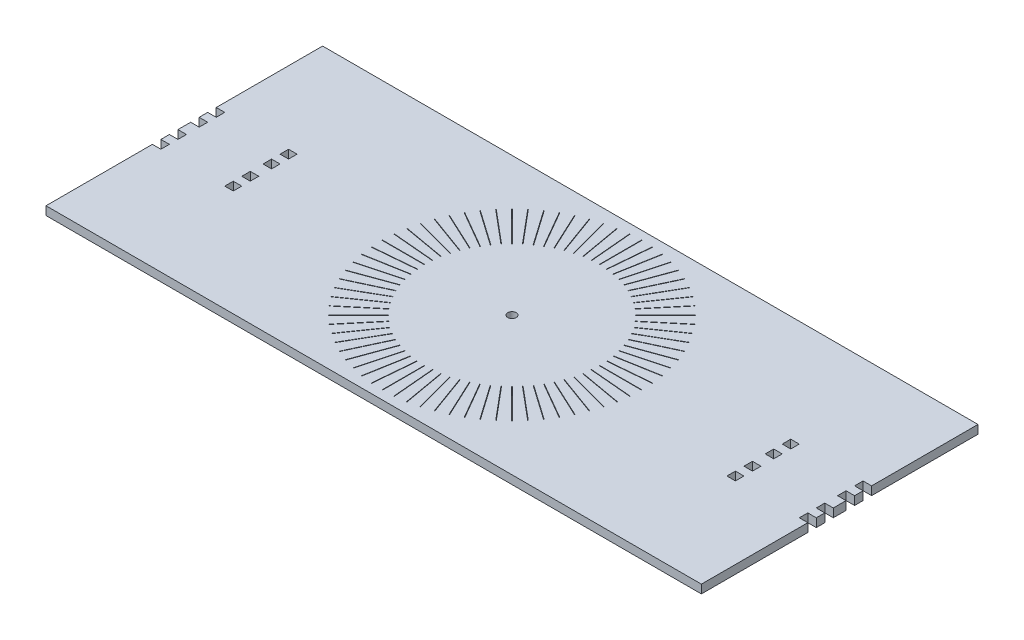
from build123d import *

# Parameters (mm, degrees)
SKETCH1_W           = 391.16
SKETCH1_H           = 165.1
SKETCH1_R           = 2.54
BOSS_EXTRUDE1_DEPTH = 5.08
SKETCH2_W           = 5.08
SKETCH2_H           = 5.08
CUT_EXTRUDE1_DEPTH  = 5.08
SKETCH3_W           = 0.254
SKETCH3_H           = 25.4
SKETCH3_W_2         = 25.4
SKETCH3_H_2         = 0.254
CUT_EXTRUDE2_DEPTH  = 5.08


with BuildPart() as part:
    # Sketch1 → Boss-Extrude1 (new body)
    with BuildSketch(Plane(origin=(0, 0, 0), x_dir=(1, 0, 0), z_dir=(0, 1, 0))):
        with Locations((43.198472727, 5.398654545)):
            Rectangle(SKETCH1_W, SKETCH1_H)
        with Locations(Location((43.198472727, 5.398654545, 0), (0, 0, 270))):
            Circle(SKETCH1_R, mode=Mode.SUBTRACT)
    extrude(amount=BOSS_EXTRUDE1_DEPTH)

    # Sketch2 → Cut-Extrude1 (cut)
    with BuildSketch(Plane(origin=(0, 5.08, 0), x_dir=(1, 0, 0), z_dir=(0, 1, 0))):
        with Locations((193.058472727, 11.748654545)):
            Rectangle(SKETCH2_W, SKETCH2_H)
        with Locations((-149.841527273, 21.908654545)):
            Rectangle(SKETCH2_W, SKETCH2_H)
        with Locations((-149.841527273, 11.748654545)):
            Rectangle(SKETCH2_W, SKETCH2_H)
        with Locations((-149.841527273, -0.951345455)):
            Rectangle(SKETCH2_W, SKETCH2_H)
        with Locations((-149.841527273, -11.111345455)):
            Rectangle(SKETCH2_W, SKETCH2_H)
        with Locations((-106.661527273, -11.111345455)):
            Rectangle(SKETCH2_W, SKETCH2_H)
        with Locations((-106.661527273, -0.951345455)):
            Rectangle(SKETCH2_W, SKETCH2_H)
        with Locations((-106.661527273, 21.908654545)):
            Rectangle(SKETCH2_W, SKETCH2_H)
        with Locations((-106.661527273, 11.748654545)):
            Rectangle(SKETCH2_W, SKETCH2_H)
        with Locations((193.058472727, 21.908654545)):
            Rectangle(SKETCH2_W, SKETCH2_H)
        with Locations((193.058472727, -0.951345455)):
            Rectangle(SKETCH2_W, SKETCH2_H)
        with Locations((193.058472727, -11.111345455)):
            Rectangle(SKETCH2_W, SKETCH2_H)
        with Locations((236.238472727, -11.111345455)):
            Rectangle(SKETCH2_W, SKETCH2_H)
        with Locations((236.238472727, -0.951345455)):
            Rectangle(SKETCH2_W, SKETCH2_H)
        with Locations((236.238472727, 11.748654545)):
            Rectangle(SKETCH2_W, SKETCH2_H)
        with Locations((236.238472727, 21.908654545)):
            Rectangle(SKETCH2_W, SKETCH2_H)
    extrude(amount=-CUT_EXTRUDE1_DEPTH, mode=Mode.SUBTRACT)

    # Sketch3 → Cut-Extrude2 (cut)
    with BuildSketch(Plane(origin=(0, 5.08, 0), x_dir=(1, 0, 0), z_dir=(0, 1, 0))):
        Polygon((50.076944845, 82.562789027), (47.863188979, 57.259443696), (47.610155525, 57.281581254), (49.823911391, 82.584926586), align=None)
        with Locations((43.198472727, 70.168654545)):
            Rectangle(SKETCH3_W, SKETCH3_H)
        Polygon((56.776067636, 81.669657853), (52.365403923, 56.655540926), (52.115262754, 56.699647563), (56.525926466, 81.71376449), align=None)
        Polygon((63.371856731, 80.196058289), (56.797852986, 55.661542302), (56.552507826, 55.727282339), (63.126511571, 80.261798327), align=None)
        Polygon((69.814114194, 78.15320532), (61.126802553, 54.285012752), (60.888120627, 54.371885868), (69.575432268, 78.240078436), align=None)
        Polygon((76.053810553, 75.556646288), (65.319306705, 52.536428497), (65.089104527, 52.643773536), (75.823608375, 75.663991326), align=None)
        Polygon((82.043457954, 72.426142577), (69.343457954, 50.429097321), (69.123487501, 50.556097321), (81.823487501, 72.553142577), align=None)
        Polygon((87.737471561, 68.785519209), (73.168630078, 47.979057284), (72.960565458, 48.124745699), (87.529406942, 68.931207624), align=None)
        Polygon((93.092516494, 64.662483527), (76.765711208, 45.204954672), (76.571135919, 45.368222725), (92.897941205, 64.82575158), align=None)
        Polygon((98.067837627, 60.088414323), (80.107325385, 42.127902081), (79.927720262, 42.307507203), (97.888232505, 60.268019445), align=None)
        Polygon((102.625569762, 55.098123024), (83.168040907, 38.771317738), (83.004772854, 38.965893026), (102.462301709, 55.292698312), align=None)
        Polygon((106.731025806, 49.72958876), (85.924563881, 35.160747277), (85.778875466, 35.368811896), (106.585337391, 49.937653379), align=None)
        Polygon((110.352960758, 44.023669319), (88.355915502, 31.323669319), (88.228915502, 31.543639772), (110.225960758, 44.243639772), align=None)
        Polygon((113.463809508, 38.023790194), (90.443591718, 27.289286345), (90.336246679, 27.519488523), (113.35646447, 38.253992371), align=None)
        Polygon((116.039896618, 31.775614086), (92.17170405, 23.088302446), (92.084830933, 23.326984371), (115.953023501, 32.014296012), align=None)
        Polygon((118.061616509, 25.32669339), (93.527100521, 18.752689644), (93.461360483, 18.998034804), (117.995876471, 25.572038549), align=None)
        Polygon((119.513582672, 18.726108285), (94.499465745, 14.315444572), (94.455359108, 14.565585741), (119.469476035, 18.976249454), align=None)
        Polygon((120.384744768, 12.024093209), (95.081399436, 9.810337344), (95.059261878, 10.063370797), (120.362607209, 12.277126663), align=None)
        with Locations((107.968472727, 5.398654545)):
            Rectangle(SKETCH3_W_2, SKETCH3_H_2)
        Polygon((120.362607209, -1.479817572), (95.059261878, 0.733938294), (95.081399436, 0.986971747), (120.384744768, -1.226784119), align=None)
        Polygon((119.469476035, -8.178940363), (94.455359108, -3.76827665), (94.499465745, -3.518135481), (119.513582672, -7.928799194), align=None)
        Polygon((117.995876471, -14.774729459), (93.461360483, -8.200725713), (93.527100521, -7.955380553), (118.061616509, -14.529384299), align=None)
        Polygon((115.953023501, -21.216986921), (92.084830933, -12.52967528), (92.17170405, -12.290993355), (116.039896618, -20.978304995), align=None)
        Polygon((113.35646447, -27.456683281), (90.336246679, -16.722179432), (90.443591718, -16.491977254), (113.463809508, -27.226481103), align=None)
        Polygon((110.225960758, -33.446330681), (88.228915502, -20.746330681), (88.355915502, -20.526360228), (110.352960758, -33.226360228), align=None)
        Polygon((106.585337391, -39.140344288), (85.778875466, -24.571502805), (85.924563881, -24.363438186), (106.731025806, -38.932279669), align=None)
        Polygon((102.462301709, -44.495389221), (83.004772854, -28.168583935), (83.168040907, -27.974008647), (102.625569762, -44.300813933), align=None)
        Polygon((97.888232505, -49.470710354), (79.927720262, -31.510198112), (80.107325385, -31.33059299), (98.067837627, -49.291105232), align=None)
        Polygon((92.897941205, -54.028442489), (76.571135919, -34.570913634), (76.765711208, -34.407645581), (93.092516494, -53.865174437), align=None)
        Polygon((87.529406942, -58.133898533), (72.960565458, -37.327436608), (73.168630078, -37.181748193), (87.737471561, -57.988210118), align=None)
        Polygon((81.823487501, -61.755833486), (69.123487501, -39.75878823), (69.343457954, -39.63178823), (82.043457954, -61.628833486), align=None)
        Polygon((75.823608375, -64.866682236), (65.089104527, -41.846464445), (65.319306705, -41.739119406), (76.053810553, -64.759337197), align=None)
        Polygon((69.575432268, -67.442769345), (60.888120627, -43.574576777), (61.126802553, -43.487703661), (69.814114194, -67.355896229), align=None)
        Polygon((63.126511571, -69.464489236), (56.552507826, -44.929973248), (56.797852986, -44.864233211), (63.371856731, -69.398749198), align=None)
        Polygon((56.525926467, -70.916455399), (52.115262754, -45.902338472), (52.365403923, -45.858231835), (56.776067636, -70.872348762), align=None)
        Polygon((49.823911391, -71.787617495), (47.610155525, -46.484272164), (47.863188979, -46.462134605), (50.076944845, -71.765479936), align=None)
        with Locations((43.198472727, -59.371345455)):
            Rectangle(SKETCH3_W, SKETCH3_H)
        Polygon((36.32000061, -71.765479936), (38.533756476, -46.462134605), (38.786789929, -46.484272164), (36.573034063, -71.787617495), align=None)
        Polygon((29.620877819, -70.872348762), (34.031541532, -45.858231835), (34.281682701, -45.902338472), (29.871018988, -70.916455399), align=None)
        Polygon((23.025088723, -69.398749198), (29.599092469, -44.864233211), (29.844437629, -44.929973248), (23.270433883, -69.464489236), align=None)
        Polygon((16.582831261, -67.355896229), (25.270142901, -43.487703661), (25.508824827, -43.574576777), (16.821513187, -67.442769345), align=None)
        Polygon((10.343134901, -64.759337197), (21.077638749, -41.739119406), (21.307840927, -41.846464445), (10.573337079, -64.866682236), align=None)
        Polygon((4.353487501, -61.628833486), (17.053487501, -39.63178823), (17.273457954, -39.75878823), (4.573457954, -61.755833486), align=None)
        Polygon((-1.340526106, -57.988210118), (13.228315377, -37.181748193), (13.436379996, -37.327436608), (-1.132461487, -58.133898533), align=None)
        Polygon((-6.695571039, -53.865174437), (9.631234247, -34.407645581), (9.825809535, -34.570913634), (-6.500995751, -54.028442489), align=None)
        Polygon((-11.670892172, -49.291105232), (6.28962007, -31.33059299), (6.469225192, -31.510198112), (-11.49128705, -49.470710354), align=None)
        Polygon((-16.228624308, -44.300813933), (3.228904548, -27.974008647), (3.392172601, -28.168583935), (-16.065356255, -44.495389221), align=None)
        Polygon((-20.334080351, -38.932279669), (0.472381574, -24.363438186), (0.618069989, -24.571502805), (-20.188391936, -39.140344288), align=None)
        Polygon((-23.956015304, -33.226360228), (-1.958970048, -20.526360228), (-1.831970048, -20.746330681), (-23.829015304, -33.446330681), align=None)
        Polygon((-27.066864054, -27.226481103), (-4.046646263, -16.491977254), (-3.939301224, -16.722179432), (-26.959519015, -27.456683281), align=None)
        Polygon((-29.642951163, -20.978304995), (-5.774758595, -12.290993355), (-5.687885479, -12.52967528), (-29.556078047, -21.216986921), align=None)
        Polygon((-31.664671054, -14.529384299), (-7.130155066, -7.955380553), (-7.064415029, -8.200725713), (-31.598931017, -14.774729459), align=None)
        Polygon((-33.116637217, -7.928799194), (-8.102520291, -3.518135481), (-8.058413654, -3.76827665), (-33.07253058, -8.178940363), align=None)
        Polygon((-33.987799313, -1.226784119), (-8.684453982, 0.986971747), (-8.662316423, 0.733938294), (-33.965661755, -1.479817572), align=None)
        with Locations((-21.571527273, 5.398654545)):
            Rectangle(SKETCH3_W_2, SKETCH3_H_2)
        Polygon((-33.965661755, 12.277126663), (-8.662316423, 10.063370797), (-8.684453982, 9.810337344), (-33.987799313, 12.024093209), align=None)
        Polygon((-33.07253058, 18.976249454), (-8.058413654, 14.565585741), (-8.102520291, 14.315444572), (-33.116637217, 18.726108285), align=None)
        Polygon((-31.598931017, 25.572038549), (-7.064415029, 18.998034804), (-7.130155066, 18.752689644), (-31.664671054, 25.32669339), align=None)
        Polygon((-29.556078047, 32.014296012), (-5.687885479, 23.326984371), (-5.774758595, 23.088302446), (-29.642951163, 31.775614086), align=None)
        Polygon((-26.959519015, 38.253992371), (-3.939301224, 27.519488523), (-4.046646263, 27.289286345), (-27.066864054, 38.023790194), align=None)
        Polygon((-23.829015304, 44.243639772), (-1.831970048, 31.543639772), (-1.958970048, 31.323669319), (-23.956015304, 44.023669319), align=None)
        Polygon((-20.188391936, 49.937653379), (0.618069989, 35.368811896), (0.472381574, 35.160747277), (-20.334080351, 49.72958876), align=None)
        Polygon((-16.065356255, 55.292698312), (3.3921726, 38.965893026), (3.228904548, 38.771317738), (-16.228624308, 55.098123024), align=None)
        Polygon((-11.49128705, 60.268019445), (6.469225192, 42.307507203), (6.28962007, 42.127902081), (-11.670892172, 60.088414323), align=None)
        Polygon((-6.500995751, 64.82575158), (9.825809535, 45.368222725), (9.631234247, 45.204954672), (-6.695571039, 64.662483527), align=None)
        Polygon((-1.132461487, 68.931207624), (13.436379996, 48.124745699), (13.228315377, 47.979057284), (-1.340526106, 68.785519209), align=None)
        Polygon((4.573457954, 72.553142577), (17.273457954, 50.556097321), (17.053487501, 50.429097321), (4.353487501, 72.426142577), align=None)
        Polygon((10.573337079, 75.663991326), (21.307840927, 52.643773536), (21.077638749, 52.536428497), (10.343134901, 75.556646288), align=None)
        Polygon((16.821513187, 78.240078436), (25.508824827, 54.371885868), (25.270142901, 54.285012752), (16.582831261, 78.15320532), align=None)
        Polygon((23.270433883, 80.261798327), (29.844437629, 55.727282339), (29.599092469, 55.661542302), (23.025088723, 80.196058289), align=None)
        Polygon((29.871018988, 81.71376449), (34.281682701, 56.699647563), (34.031541532, 56.655540926), (29.620877819, 81.669657853), align=None)
        Polygon((36.573034063, 82.584926586), (38.786789929, 57.281581254), (38.533756476, 57.259443696), (36.32000061, 82.562789027), align=None)
    extrude(amount=-CUT_EXTRUDE2_DEPTH, mode=Mode.SUBTRACT)


solid = part.part
